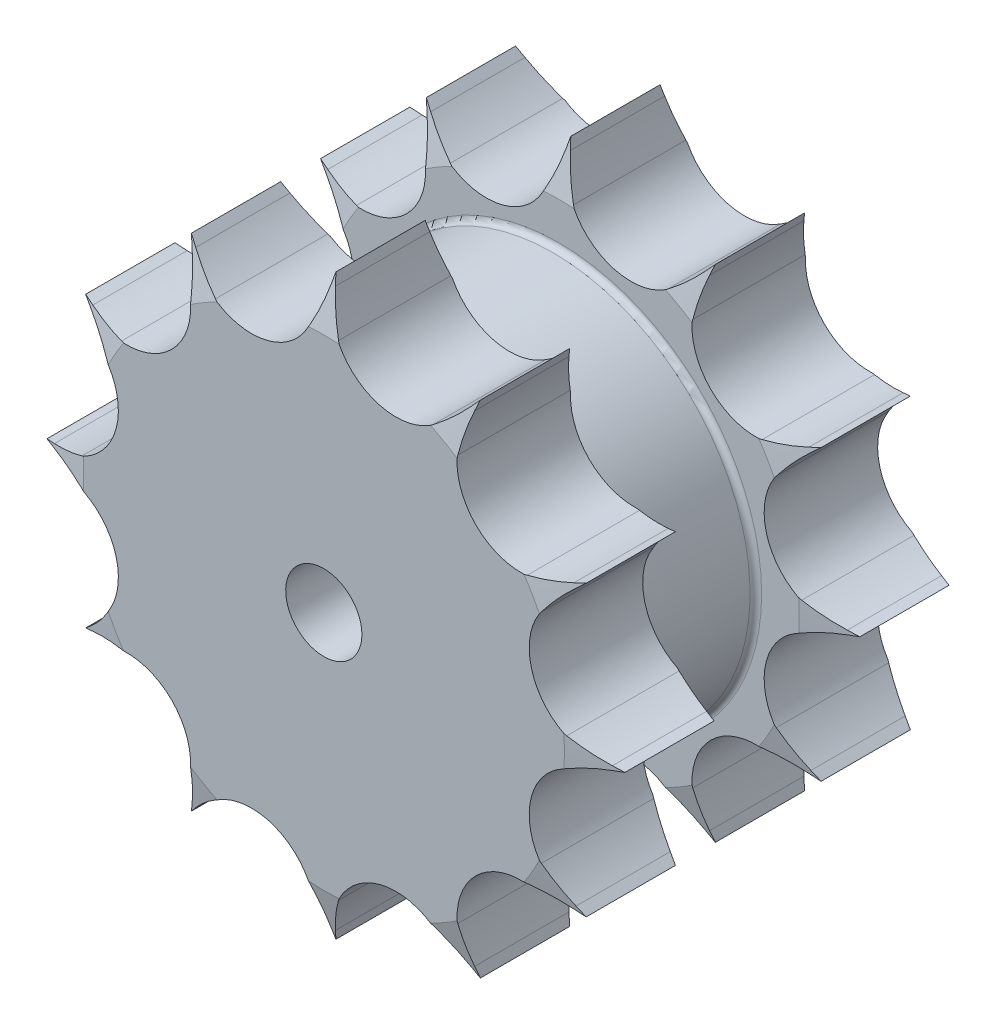
from build123d import *

# Parameters (mm, degrees)
CUT_EXTRUDE1_DEPTH      = 67.047380511
CIRPATTERN1_COUNT       = 12
CUT_EXTRUDE2_DEPTH      = 67.950378696
CUT_EXTRUDE2_DEPTH_BACK = 67.950378696
SKETCH3_R               = 4.75


with BuildPart() as part:
    # Sketch1 → Revolve1 (revolve)
    with BuildSketch(Plane(origin=(0, 0, 0), x_dir=(0, 0, -1), z_dir=(1, 0, 0))):
        with BuildLine():
            Line((7.0739, 0), (-7.0739, 0))
            Line((-7.0739, 0), (-22.2123, 0))
            Line((-22.2123, 0), (-36.3601, 0))
            Line((-36.3601, 0), (-36.3601, 29.988457268))
            Line((-36.3601, 29.988457268), (-34.1101, 38.988457268))
            Line((-34.1101, 38.988457268), (-24.4623, 38.988457268))
            Line((-24.4623, 38.988457268), (-22.2123, 29.988457268))
            Line((-22.2123, 29.988457268), (-22.2123, 25.293457268))
            ThreePointArc((-22.2123, 25.293457268), (-22.001416882, 24.784340386), (-21.4923, 24.573457268))
            Line((-21.4923, 24.573457268), (-7.7939, 24.573457268))
            ThreePointArc((-7.7939, 24.573457268), (-7.284783118, 24.784340386), (-7.0739, 25.293457268))
            Line((-7.0739, 25.293457268), (-7.0739, 29.988457268))
            Line((-7.0739, 29.988457268), (-4.8239, 38.988457268))
            Line((-4.8239, 38.988457268), (4.8239, 38.988457268))
            Line((4.8239, 38.988457268), (7.0739, 29.988457268))
            Line((7.0739, 29.988457268), (7.0739, 0))
        make_face()
    revolve(axis=Axis((0, 0, -7.0739), (0, 0, 1)))

    # Sketch0 → Cut-Extrude1 (cut, symmetric)
    with BuildSketch(Plane.XY):
        with BuildLine():
            Line((18.203791247, -31.41402312), (17.163077261, -30.244582274))
            ThreePointArc((17.163077261, -30.244582274), (15.462685215, -28.544190228), (13.576387143, -27.052699092))
            ThreePointArc((13.576387143, -27.052699092), (6.93496372, -25.881636952), (1.768853388, -30.216518226))
            ThreePointArc((1.768853388, -30.216518226), (0.881016907, -32.451336475), (0.258630222, -34.774115207))
            Line((0.258630222, -34.774115207), (-0.057934105, -36.307237681))
            ThreePointArc((-0.057934105, -36.307237681), (-6.825983756, -45.412838111), (-18.150661166, -46.098503363))
            ThreePointArc((-18.150661166, -46.098503363), (12.822697195, -47.85495742), (38.768185347, -30.847144405))
            ThreePointArc((38.768185347, -30.847144405), (28.617894394, -35.915679584), (18.203791247, -31.41402312))
        make_face()
    cut_extrude1 = extrude(amount=CUT_EXTRUDE1_DEPTH, both=True, mode=Mode.SUBTRACT)

    # CirPattern1: Cut-Extrude1 ×12 about axis
    cirpattern1_axis = Axis((0, 0, 0), (0, 0, 1))
    for i in range(1, CIRPATTERN1_COUNT):
        add(cut_extrude1.rotate(cirpattern1_axis, i * 360 / CIRPATTERN1_COUNT), mode=Mode.SUBTRACT)

    # Sketch3 → Cut-Extrude2 (cut, two sides: drawn at the far end of the back side and taken through both)
    with BuildSketch(Plane.XY.offset(36.3601).offset(-CUT_EXTRUDE2_DEPTH_BACK)):
        Circle(SKETCH3_R)
    extrude(amount=CUT_EXTRUDE2_DEPTH + CUT_EXTRUDE2_DEPTH_BACK, mode=Mode.SUBTRACT)


solid = part.part
